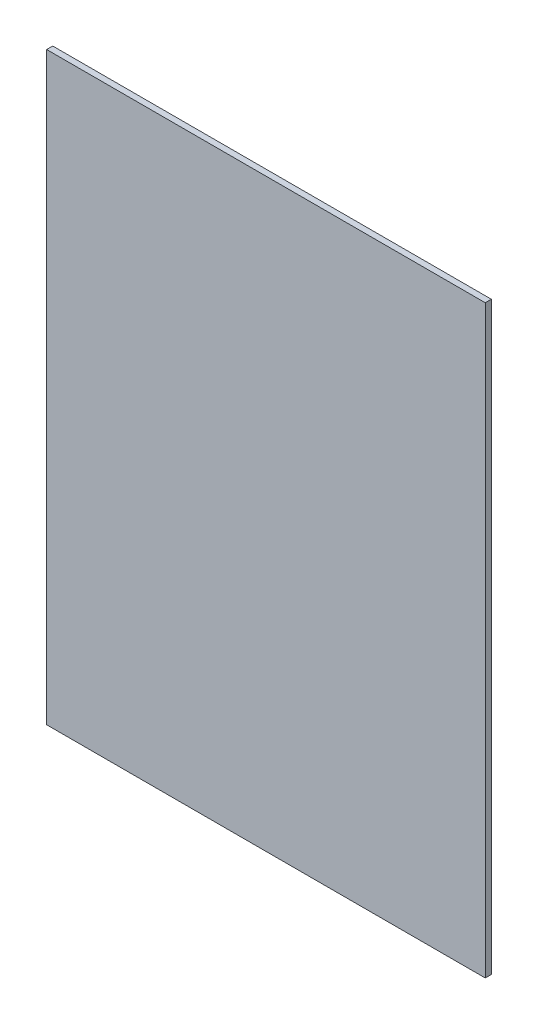
from build123d import *

# Parameters (mm, degrees)
SKETCH1_W           = 1371.6
SKETCH1_H           = 1828.8
BOSS_EXTRUDE1_DEPTH = 19.05


with BuildPart() as part:
    # Sketch1 → Boss-Extrude1 (new body)
    with BuildSketch(Plane.XY):
        with Locations((685.8, -914.4)):
            Rectangle(SKETCH1_W, SKETCH1_H)
    extrude(amount=BOSS_EXTRUDE1_DEPTH)


solid = part.part
